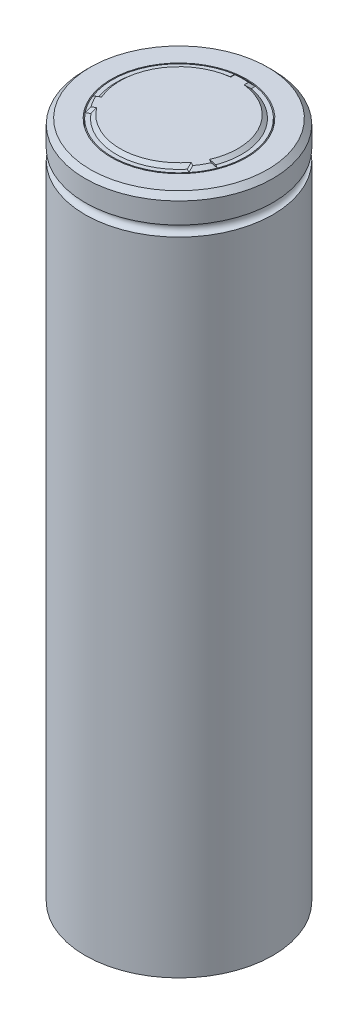
from build123d import *

# Parameters (mm, degrees)
SKETCH_1_R          = 9
EXTRUDE_1_DEPTH     = 65
SKETCH_2_R          = 0.5
CHAMFER_1_SIZE      = 0.5
SKETCH_3_R          = 6.5
SKETCH_3_R_2        = 6.4
CUT_EXTRUDE_1_DEPTH = 65
EXTRUDE_2_DEPTH     = 0.3
EXTRUDE_2_DRAFT     = 50


with BuildPart() as part:
    # Эскиз1 → Бобышка-Вытянуть1 (new body)
    with BuildSketch(Plane(origin=(0, 0, 0), x_dir=(1, 0, 0), z_dir=(0, 1, 0))):
        with Locations(Location((0, 0, 0), (0, 0, 270))):
            Circle(SKETCH_1_R)
    extrude(amount=EXTRUDE_1_DEPTH)

    # Эскиз2 → Вырез-Повернуть1 (revolve, cut)
    with BuildSketch(Plane.XY, mode=Mode.PRIVATE) as cut_revolve_1_sk:
        with Locations((-9, 62)):
            Circle(SKETCH_2_R)
    revolve(cut_revolve_1_sk.sketch.rotate(Axis((0, 0, 0), (0, 1, 0)), 270), axis=Axis((0, 0, 0), (0, 1, 0)), mode=Mode.SUBTRACT)

    # Фаска1
    chamfer_1_edges = [part.edges().sort_by_distance(p)[0] for p in [
        (0, 65, -9),
    ]]
    chamfer(chamfer_1_edges, length=CHAMFER_1_SIZE)

    # Эскиз3 → Вырез-Вытянуть1 (cut)
    with BuildSketch(Plane.XZ):
        with Locations(Location((0, 0, 0), (0, 0, 270))):
            Circle(SKETCH_3_R)
        with Locations(Location((0, 0, 0), (0, 0, 270))):
            Circle(SKETCH_3_R_2, mode=Mode.SUBTRACT)
    extrude(amount=-CUT_EXTRUDE_1_DEPTH, mode=Mode.SUBTRACT)


with BuildPart() as cut_extrude_1_piece_1:
    # of the separate pieces the step leaves, piece 1, a body of its own (cut_extrude_1_pieces)
    add(part.part.solids().sort_by_distance((0, 65, -6.4))[0])


with BuildPart() as cut_extrude_1_piece_2:
    # of the separate pieces the step leaves, piece 2, a body of its own (cut_extrude_1_pieces)
    add(part.part.solids().sort_by_distance((0, 64.5, 9))[0])


with BuildPart() as extrude_2_tool:
    # Эскиз4 → Бобышка-Вытянуть2 (with draft: the straight prism first)
    with BuildSketch(Plane(origin=(0, 65, 0), x_dir=(1, 0, 0), z_dir=(0, 1, 0))):
        with BuildLine():
            ThreePointArc((-1, 5.916079783), (-5.196152423, 3), (-5.623475383, -2.092014488))
            Line((-5.623475383, -2.092014488), (-5.974486277, -2.294670722))
            ThreePointArc((-5.974486277, -2.294670722), (-5.542562584, -3.2), (-4.974486277, -4.02672153))
            Line((-4.974486277, -4.02672153), (-4.623475383, -3.824065295))
            ThreePointArc((-4.623475383, -3.824065295), (0, -6), (4.623475383, -3.824065295))
            Line((4.623475383, -3.824065295), (4.974486277, -4.02672153))
            ThreePointArc((4.974486277, -4.02672153), (5.542562584, -3.2), (5.974486277, -2.294670722))
            Line((5.974486277, -2.294670722), (5.623475383, -2.092014488))
            ThreePointArc((5.623475383, -2.092014488), (5.196152423, 3), (1, 5.916079783))
            Line((1, 5.916079783), (1, 6.321392252))
            ThreePointArc((1, 6.321392252), (0, 6.4), (-1, 6.321392252))
            Line((-1, 6.321392252), (-1, 5.916079783))
        make_face()
    extrude(amount=EXTRUDE_2_DEPTH)
    # Бобышка-Вытянуть2: the draft: its side faces are tilted about the plane it starts from
    extrude_2_sides = [extrude_2_tool.faces().sort_by_distance(p)[0] for p in [
        (5.196152423, 65.15, -3),
        (1, 65.15, -6.118736017),
        (0, 65.15, -6.4),
        (-1, 65.15, -6.118736017),
        (-5.196152423, 65.15, -3),
        (-5.79898083, 65.15, 2.193342605),
        (-5.542562584, 65.15, 3.2),
        (-4.79898083, 65.15, 3.925393412),
        (0, 65.15, 6),
        (4.79898083, 65.15, 3.925393412),
        (5.542562584, 65.15, 3.2),
        (5.79898083, 65.15, 2.193342605),
    ]]
    draft(extrude_2_sides, Plane(origin=(0, 65, 0), x_dir=(1, 0, 0), z_dir=(0, 1, 0)), EXTRUDE_2_DRAFT)


with BuildPart() as cut_extrude_1_piece_1_1:
    add(cut_extrude_1_piece_1.part)

    # Бобышка-Вытянуть2: add extrude_2_tool
    add(extrude_2_tool.part)


solid = Compound([cut_extrude_1_piece_2.part, cut_extrude_1_piece_1_1.part])
